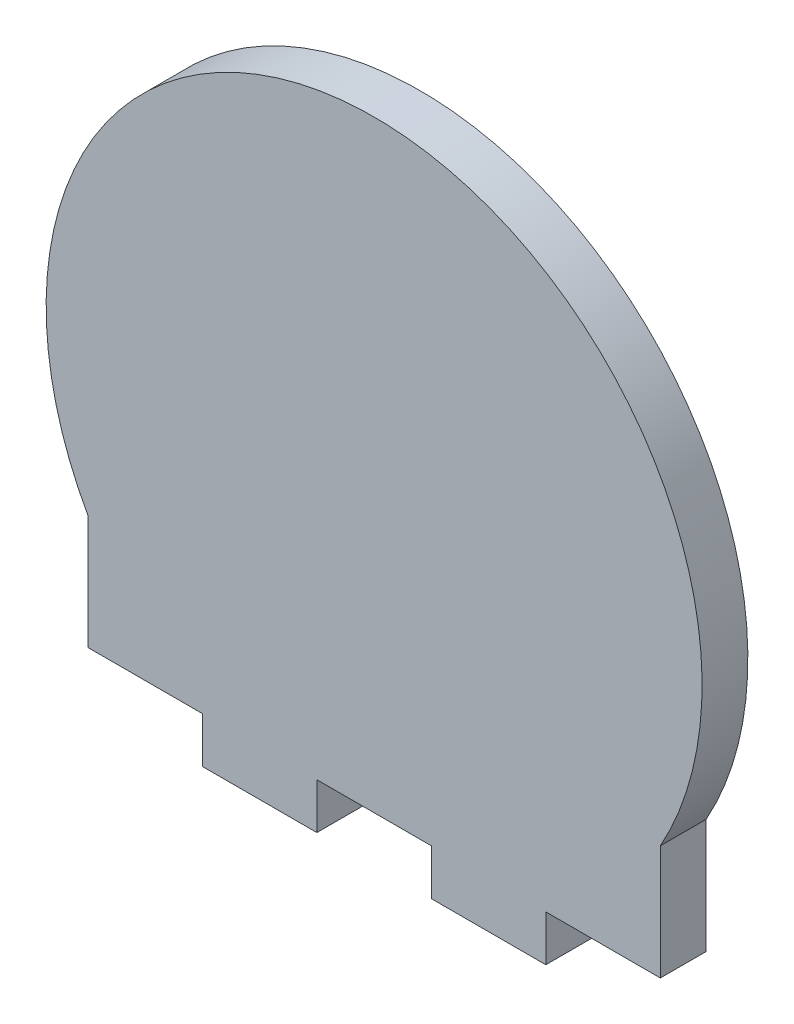
from build123d import *

# Parameters (mm, degrees)
BOSS_EXTRUDE1_DEPTH = 4


with BuildPart() as part:
    # Sketch1 → Boss-Extrude1 (new body)
    with BuildSketch(Plane.XY):
        with BuildLine():
            Line((0, 0), (10, 0))
            Line((10, 0), (10, -4))
            Line((10, -4), (20, -4))
            Line((20, -4), (20, 0))
            Line((20, 0), (30, 0))
            Line((30, 0), (30, -4))
            Line((30, -4), (40, -4))
            Line((40, -4), (40, 0))
            Line((40, 0), (50, 0))
            Line((50, 0), (50, 10))
            ThreePointArc((50, 10), (25, 52.632453378), (0, 10))
            Line((0, 10), (0, 0))
        make_face()
    extrude(amount=BOSS_EXTRUDE1_DEPTH)


solid = part.part
